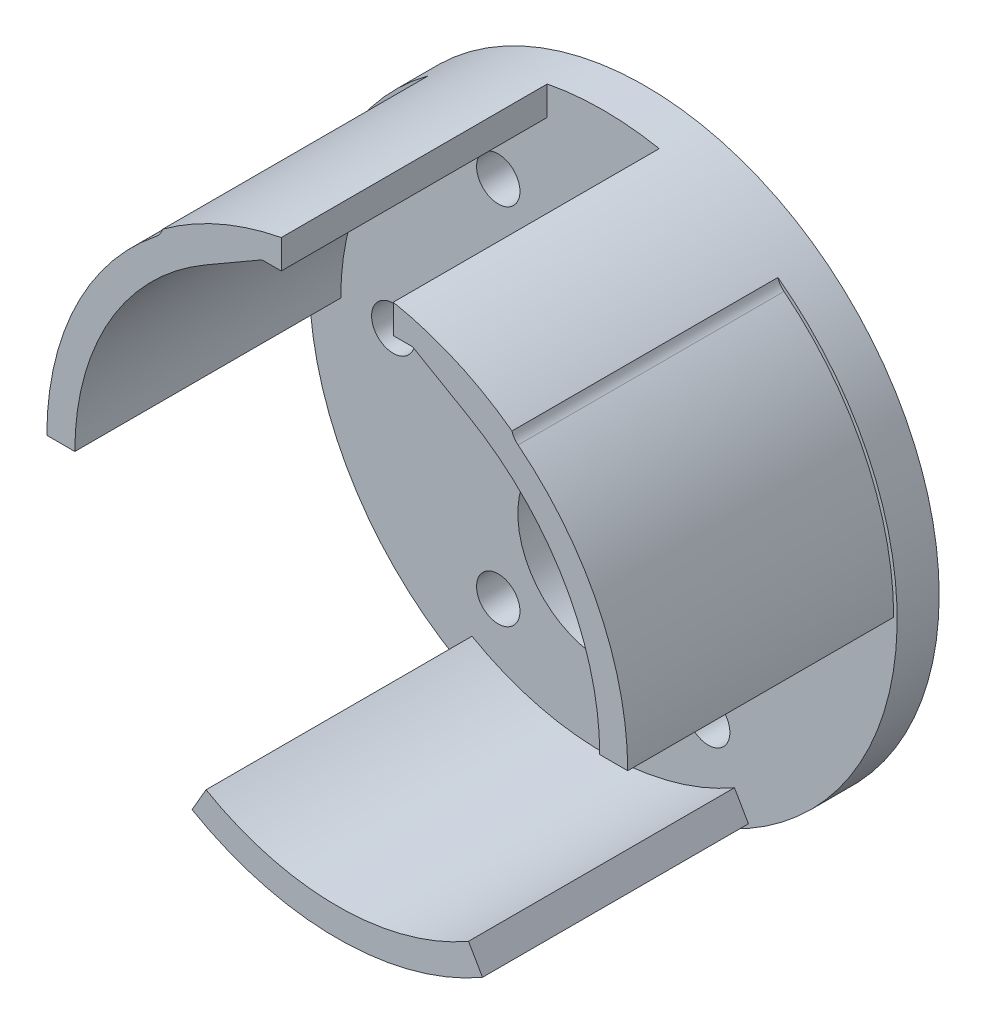
from build123d import *

# Parameters (mm, degrees)
SKETCH1_R           = 2.5
SKETCH1_R_2         = 6.1
SKETCH1_R_3         = 1.55
BOSS_EXTRUDE1_DEPTH = 3
BOSS_EXTRUDE2_DEPTH = 39
BOSS_EXTRUDE3_DEPTH = 39
CUT_EXTRUDE1_DEPTH  = 3
BOSS_EXTRUDE4_DEPTH = 34
BOSS_EXTRUDE5_DEPTH = 3
CUT_EXTRUDE3_DEPTH  = 77.336426429
CUT_EXTRUDE4_START  = -10
SKETCH9_W           = 115.741675956
SKETCH9_H           = 76.731693644
SKETCH9_R           = 21
CUT_EXTRUDE4_DEPTH  = 10
SKETCH10_W          = 52.464416267
SKETCH10_H          = 51.664843315
CUT_EXTRUDE5_DEPTH  = 20


with BuildPart() as part:
    # Sketch1 → Boss-Extrude1 (new body)
    with BuildSketch(Plane.XY):
        with BuildLine():
            Line((-48.416861363, 3.650350453), (-11.959014769, 37.776226585))
            ThreePointArc((-11.959014769, 37.776226585), (0, 42.5), (11.959014769, 37.776226585))
            Line((11.959014769, 37.776226585), (48.416861363, 3.650350453))
            ThreePointArc((48.416861363, 3.650350453), (49.946989961, -0.726147591), (47.22369092, -4.478303104))
            Line((47.22369092, -4.478303104), (17.66776819, -19.154227328))
            ThreePointArc((17.66776819, -19.154227328), (16.856525691, -19.446371641), (16, -19.5455))
            Line((16, -19.5455), (-16, -19.5455))
            ThreePointArc((-16, -19.5455), (-16.856525691, -19.446371641), (-17.66776819, -19.154227328))
            Line((-17.66776819, -19.154227328), (-47.22369092, -4.478303104))
            ThreePointArc((-47.22369092, -4.478303104), (-49.946989961, -0.726147591), (-48.416861363, 3.650350453))
        make_face()
        with Locations((-25, 0)):
            Circle(SKETCH1_R, mode=Mode.SUBTRACT)
        with Locations((0, -5.5455)):
            Circle(SKETCH1_R_2, mode=Mode.SUBTRACT)
        with Locations((-7.5, 14.444881057)):
            Circle(SKETCH1_R_3, mode=Mode.SUBTRACT)
        with Locations((-15, 1.4545)):
            Circle(SKETCH1_R_3, mode=Mode.SUBTRACT)
        with Locations((-7.5, -11.535881057)):
            Circle(SKETCH1_R_3, mode=Mode.SUBTRACT)
        with Locations(Location((7.5, -11.535881057, 0), (0, 0, 180))):
            Circle(SKETCH1_R_3, mode=Mode.SUBTRACT)
        with Locations(Location((7.5, 14.444881057, 0), (0, 0, 180))):
            Circle(SKETCH1_R_3, mode=Mode.SUBTRACT)
        with Locations(Location((15, 1.4545, 0), (0, 0, 180))):
            Circle(SKETCH1_R_3, mode=Mode.SUBTRACT)
        with Locations(Location((25, 0, 0), (0, 0, 180))):
            Circle(SKETCH1_R, mode=Mode.SUBTRACT)
        with Locations((-45, 0)):
            Circle(SKETCH1_R, mode=Mode.SUBTRACT)
        with Locations(Location((45, 0, 0), (0, 0, 180))):
            Circle(SKETCH1_R, mode=Mode.SUBTRACT)
        with Locations((-16, -15.7955)):
            Circle(SKETCH1_R, mode=Mode.SUBTRACT)
        with Locations(Location((16, -15.7955, 0), (0, 0, 180))):
            Circle(SKETCH1_R, mode=Mode.SUBTRACT)
    extrude(amount=BOSS_EXTRUDE1_DEPTH)

    # Sketch2 → Boss-Extrude2 (add)
    with BuildSketch(Plane.XY.offset(3)):
        with BuildLine():
            Line((-20.75, 1.4545), (-18.75, 1.4545))
            ThreePointArc((-18.75, 1.4545), (-16.237976321, 10.8295), (-9.375, 17.692476321))
            Line((-9.375, 17.692476321), (-10.375, 19.424527129))
            ThreePointArc((-10.375, 19.424527129), (-17.970027129, 11.8295), (-20.75, 1.4545))
        make_face()
        with BuildLine():
            Line((-10.375, -16.515527129), (-9.375, -14.783476321))
            ThreePointArc((-9.375, -14.783476321), (0, -17.2955), (9.375, -14.783476321))
            Line((9.375, -14.783476321), (10.375, -16.515527129))
            ThreePointArc((10.375, -16.515527129), (0, -19.2955), (-10.375, -16.515527129))
        make_face()
        with BuildLine():
            ThreePointArc((18.75, 1.4545), (16.237976321, 10.8295), (9.375, 17.692476321))
            Line((9.375, 17.692476321), (10.375, 19.424527129))
            ThreePointArc((10.375, 19.424527129), (17.970027129, 11.8295), (20.75, 1.4545))
            Line((20.75, 1.4545), (18.75, 1.4545))
        make_face()
    extrude(amount=BOSS_EXTRUDE2_DEPTH)

    # Sketch3 → Boss-Extrude3 (add)
    with BuildSketch(Plane.XY.offset(3)):
        with BuildLine():
            Line((-17.5, 29), (-17.5, 23))
            Line((-17.5, 23), (-4, 23))
            Line((-4, 23), (-4, 20))
            Line((-4, 20), (-5.378251748, 20))
            Line((-5.378251748, 20), (-9.375, 17.692476321))
            Line((-9.375, 17.692476321), (-12.918615444, 17.692476321))
            ThreePointArc((-12.918615444, 17.692476321), (-12.502444344, 19.132335325), (-13.724553319, 20))
            Line((-13.724553319, 20), (-20.5, 20))
            Line((-20.5, 20), (-20.5, 29))
            Line((-20.5, 29), (-17.5, 29))
        make_face()
    boss_extrude3 = extrude(amount=BOSS_EXTRUDE3_DEPTH)

    # Mirror1: Boss-Extrude3 across plane
    add(boss_extrude3.mirror(Plane(origin=(0, 0, 0), x_dir=(0, 0, 1), z_dir=(1, 0, 0))))

    # Sketch4 → Cut-Extrude1 (cut)
    with BuildSketch(Plane(origin=(0, 23, 0), x_dir=(1, 0, 0), z_dir=(0, 1, 0))):
        with BuildLine():
            Line((-14.224553319, -17.5), (-14.224553319, -27.5))
            ThreePointArc((-14.224553319, -27.5), (-15.724553319, -29), (-17.224553319, -27.5))
            Line((-17.224553319, -27.5), (-17.224553319, -17.5))
            ThreePointArc((-17.224553319, -17.5), (-15.724553319, -16), (-14.224553319, -17.5))
        make_face()
        with BuildLine():
            Line((14.224553319, -17.5), (14.224553319, -27.5))
            ThreePointArc((14.224553319, -27.5), (15.724553319, -29), (17.224553319, -27.5))
            Line((17.224553319, -27.5), (17.224553319, -17.5))
            ThreePointArc((17.224553319, -17.5), (15.724553319, -16), (14.224553319, -17.5))
        make_face()
    extrude(amount=-CUT_EXTRUDE1_DEPTH, mode=Mode.SUBTRACT)

    # Sketch5 → Boss-Extrude4 (add)
    with BuildSketch(Plane.XY.offset(3)):
        Polygon((-43.784396435, 23.346849864), (-43.784396435, 6.040412882), (-29.176551712, -7.739510205), (-18.086117895, -7.739510205), (-18.086117895, -4.739510205), (-27.984845454, -4.739510205), (-40.784396435, 7.334606915), (-40.784396435, 23.346849864), align=None)
    boss_extrude4 = extrude(amount=BOSS_EXTRUDE4_DEPTH)

    # Mirror2: Boss-Extrude4 across plane
    add(boss_extrude4.mirror(Plane(origin=(0, 0, 0), x_dir=(0, 0, 1), z_dir=(1, 0, 0))))

    # Sketch6 → Boss-Extrude5 (add)
    with BuildSketch(Plane(origin=(0, 0, 3), x_dir=(-1, 0, 0), z_dir=(0, 0, -1))):
        Polygon((40.784396435, 23.346849864), (40.784396435, 10.794616422), (43.784396435, 7.986506839), (43.784396435, 23.346849864), align=None)
        Polygon((-43.784396435, 23.346849864), (-43.784396435, 7.986506839), (-40.784396435, 10.794616422), (-40.784396435, 23.346849864), align=None)
    extrude(amount=BOSS_EXTRUDE5_DEPTH)

    # Sketch8 → Cut-Extrude3 (cut, through all)
    with BuildSketch(Plane.XY.offset(3)):
        with BuildLine():
            Line((50.685566108, 53.585257373), (-51.78645156, 53.585257373))
            Line((-51.78645156, 53.585257373), (-51.78645156, -24.701187201))
            Line((-51.78645156, -24.701187201), (50.685566108, -24.701187201))
            Line((50.685566108, -24.701187201), (50.685566108, -10.970768248))
            Line((50.685566108, -10.970768248), (16.929639954, -10.970768248))
            ThreePointArc((16.929639954, -10.970768248), (0, -19.5455), (-16.929639954, -10.970768248))
            Line((-16.929639954, -10.970768248), (-24.865040571, -10.970768248))
            Line((-24.865040571, -10.970768248), (-24.865040571, -1.968887806))
            Line((-24.865040571, -1.968887806), (-20.719083376, -1.968887806))
            ThreePointArc((-20.719083376, -1.968887806), (-1.717447104, 22.384153018), (21, 1.4545))
            ThreePointArc((21, 1.4545), (20.929653018, -0.262947104), (20.719083376, -1.968887806))
            Line((20.719083376, -1.968887806), (50.685566108, -1.968887806))
            Line((50.685566108, -1.968887806), (50.685566108, 53.585257373))
        make_face()
        with BuildLine():
            ThreePointArc((16.929639954, -10.970768248), (19.354974941, -6.693195689), (20.719083376, -1.968887806))
            Line((20.719083376, -1.968887806), (-20.719083376, -1.968887806))
            ThreePointArc((-20.719083376, -1.968887806), (-19.354974941, -6.693195689), (-16.929639954, -10.970768248))
            Line((-16.929639954, -10.970768248), (16.929639954, -10.970768248))
        make_face()
        with BuildLine():
            ThreePointArc((-16.929639954, -10.970768248), (-19.354974941, -6.693195689), (-20.719083376, -1.968887806))
            Line((-20.719083376, -1.968887806), (-24.865040571, -1.968887806))
            Line((-24.865040571, -1.968887806), (-24.865040571, -10.970768248))
            Line((-24.865040571, -10.970768248), (-16.929639954, -10.970768248))
        make_face()
        with BuildLine():
            Line((50.685566108, -10.970768248), (50.685566108, -1.968887806))
            Line((50.685566108, -1.968887806), (20.719083376, -1.968887806))
            ThreePointArc((20.719083376, -1.968887806), (19.354974941, -6.693195689), (16.929639954, -10.970768248))
            Line((16.929639954, -10.970768248), (50.685566108, -10.970768248))
        make_face()
    extrude(amount=CUT_EXTRUDE3_DEPTH, mode=Mode.SUBTRACT)

    # Sketch9 → Cut-Extrude4 (cut)
    with BuildSketch(Plane.XY.offset(3).offset(CUT_EXTRUDE4_START)):
        with Locations((-2.250274658, 10.895525105)):
            Rectangle(SKETCH9_W, SKETCH9_H)
        with Locations(Location((0, 1.4545, 0), (0, 0, 126.468628992))):
            Circle(SKETCH9_R, mode=Mode.SUBTRACT)
    extrude(amount=CUT_EXTRUDE4_DEPTH, mode=Mode.SUBTRACT)

    # Sketch10 → Cut-Extrude5 (cut)
    with BuildSketch(Plane.XY.offset(42)):
        with Locations((-1.737703473, -0.030968104)):
            Rectangle(SKETCH10_W, SKETCH10_H)
    extrude(amount=-CUT_EXTRUDE5_DEPTH, mode=Mode.SUBTRACT)


solid = part.part
